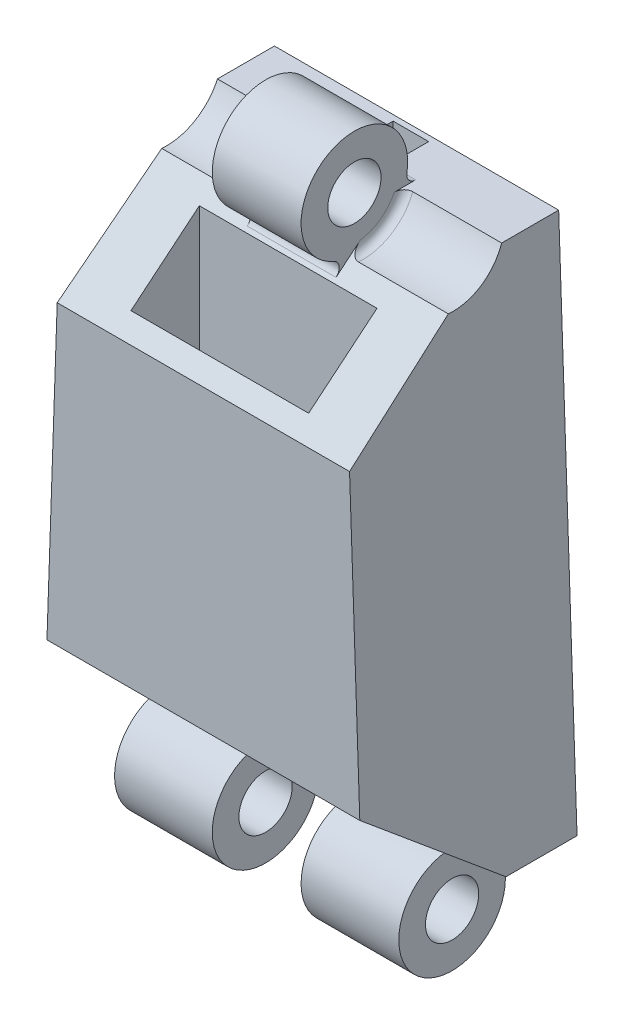
from build123d import *

# Parameters (mm, degrees)
BOSS_EXTRUDE2_DEPTH            = 12
CUT_EXTRUDE2_DEPTH             = 22.571014648492383
CUT_EXTRUDE2_DEPTH_BACK        = 22.571014648492383
SKETCH17_R                     = 3.0000000000000298
SKETCH17_R_2                   = 1.5
BOSS_EXTRUDE3_DEPTH            = 2.5
CUT_EXTRUDE3_DEPTH             = 25.679395227729078
CUT_EXTRUDE3_DEPTH_BACK        = 25.679395227729078
SKETCH19_R                     = 1.4999999999999996
BOSS_EXTRUDE4_DEPTH            = 8
SKETCH19_3_R                   = 3.0000000000000004
CUT_EXTRUDE4_DEPTH             = 2.5
CUT_EXTRUDE5_START             = 10
SKETCH20_R                     = 2.9999999999999996
CUT_EXTRUDE5_DEPTH             = 10
SKETCH21_R                     = 2.999999999999999
CUT_EXTRUDE6_DEPTH             = 10
FILLET6_R                      = 0.5000000000000004
FILLET7_R                      = 0.5000000000000004
FILLET8_R                      = 0.5000000000000004
CUT_EXTRUDE7_REACH             = 27.076
CUT_EXTRUDE7_DIRECTION_2_REACH = 27.076
CUT_EXTRUDE8_DEPTH             = 1


with BuildPart() as part:
    # Sketch1 → Boss-Extrude2 (new body)
    with BuildSketch(Plane.XY):
        Polygon((-7.999999999999995, -14.500000000000002), (-6.966131724806635, 15.482179980607619), (9.033868275193369, 15.482179980607619), (10.067736550386755, -14.500000000000002), align=None)
    extrude(amount=BOSS_EXTRUDE2_DEPTH)

    # Sketch16 → Cut-Extrude2 (cut, two sides: drawn at the far end of the back side and taken through both)
    with BuildSketch(Plane(origin=(1.0338682751933665, 0, 0), x_dir=(0, 0, -1), z_dir=(1, 0, 0)).offset(-CUT_EXTRUDE2_DEPTH_BACK)):
        Polygon((-12, 8.852541981440545), (-4, 15.482179980607619), (-12, 15.482179980607619), align=None)
    extrude(amount=CUT_EXTRUDE2_DEPTH + CUT_EXTRUDE2_DEPTH_BACK, mode=Mode.SUBTRACT)

    # Sketch17 → Boss-Extrude3 (add, symmetric)
    with BuildSketch(Plane(origin=(1.0338682751933665, 0, 0), x_dir=(0, 0, -1), z_dir=(1, 0, 0))):
        with Locations((-6.000000000000029, 16.582179980607627)):
            Circle(SKETCH17_R)
        with Locations((-6.000000000000001, 16.58217998060762)):
            Circle(SKETCH17_R_2, mode=Mode.SUBTRACT)
    extrude(amount=BOSS_EXTRUDE3_DEPTH, both=True)

    # Sketch18 → Cut-Extrude3 (cut, two sides: drawn at the far end of the back side and taken through both)
    with BuildSketch(Plane(origin=(1.0338682751933665, 0, 0), x_dir=(0, 0, -1), z_dir=(1, 0, 0)).offset(-CUT_EXTRUDE3_DEPTH_BACK)):
        Polygon((-12, -14.500000000000002), (-4, -14.500000000000002), (-12, -7.870362000832929), align=None)
    extrude(amount=CUT_EXTRUDE3_DEPTH + CUT_EXTRUDE3_DEPTH_BACK, mode=Mode.SUBTRACT)

    # Sketch19 → Boss-Extrude4 (add, symmetric)
    with BuildSketch(Plane(origin=(1.0338682751933665, 0, 0), x_dir=(0, 0, -1), z_dir=(1, 0, 0))):
        with BuildLine():
            ThreePointArc((-8.791057147390573, -14.500000000000002), (-6.5598341530436866, -18.547301430306355), (-2.9999999999999996, -15.600000000000003))
            ThreePointArc((-2.9999999999999996, -15.600000000000003), (-3.0526985696936495, -15.040165846956317), (-3.2089428526094275, -14.500000000000002))
            ThreePointArc((-3.2089428526094275, -14.500000000000002), (-6, -12.600000000000003), (-8.791057147390573, -14.500000000000002))
        make_face()
        with Locations((-6, -15.600000000000003)):
            Circle(SKETCH19_R, mode=Mode.SUBTRACT)
    extrude(amount=BOSS_EXTRUDE4_DEPTH, both=True)

    # Sketch19<3> → Cut-Extrude4 (cut, symmetric)
    with BuildSketch(Plane(origin=(1.0338682751933665, 0, 0), x_dir=(0, 0, -1), z_dir=(1, 0, 0))):
        with Locations((-6, -15.600000000000003)):
            Circle(SKETCH19_3_R)
    extrude(amount=CUT_EXTRUDE4_DEPTH, both=True, mode=Mode.SUBTRACT)

    # Sketch20 → Cut-Extrude5 (cut)
    with BuildSketch(Plane(origin=(3.5338682751933668, 0, 0), x_dir=(0, 0, -1), z_dir=(1, 0, 0)).offset(CUT_EXTRUDE5_START)):
        with Locations((-6, 16.58217998060762)):
            Circle(SKETCH20_R)
    extrude(amount=-CUT_EXTRUDE5_DEPTH, mode=Mode.SUBTRACT)

    # Sketch21 → Cut-Extrude6 (cut)
    with BuildSketch(Plane.ZY.offset(1.4661317248066335)):
        with Locations((6, 16.58217998060762)):
            Circle(SKETCH21_R)
    extrude(amount=CUT_EXTRUDE6_DEPTH, mode=Mode.SUBTRACT)

    # Fillet6
    fillet6_edges = [part.edges().sort_by_distance(p)[0] for p in [
        (1.0338682751933665, 13.59501804601977, 6.277242811538059),
    ]]
    fillet(fillet6_edges, radius=FILLET6_R)

    # Fillet7
    fillet7_edges = [part.edges().sort_by_distance(p)[0] for p in [
        (1.0338682751933665, 15.482179980607619, 3.208942852609428),
    ]]
    fillet(fillet7_edges, radius=FILLET7_R)

    # Fillet8
    fillet8_edges = [part.edges().sort_by_distance(p)[0] for p in [
        (3.5338682751933668, 14.026824950601753, 4.428325520146199),
        (-1.4661317248066335, 14.026824950601755, 4.428325520146199),
    ]]
    fillet(fillet8_edges, radius=FILLET8_R)

    # Cut-Extrude7: up to this plane
    cut_extrude7_end = Plane(origin=(-7.999999999999995, -10.561614048947142, 8.752459728929596), z_dir=(0, 0.769971126082772, -0.6380787294674758))
    # Sketch23 → Cut-Extrude7 (cut, up to the surface)
    with BuildSketch(Plane(origin=(0, 0, 0), x_dir=(1, 0, 0), z_dir=(0, 1, 0)), mode=Mode.PRIVATE) as cut_extrude7_sk1:
        Polygon((-3.966131724806632, -7.226179018286816), (-3.966131724806632, -11.076034648700675), (6.0338682751933685, -11.076034648700674), (6.0338682751933685, -7.226179018286816), align=None)
    cut_extrude7_tool1 = split(extrude(cut_extrude7_sk1.sketch, amount=-CUT_EXTRUDE7_REACH, mode=Mode.PRIVATE), bisect_by=cut_extrude7_end, keep=Keep.BOTH, mode=Mode.PRIVATE)
    add(cut_extrude7_tool1.solids().sort_by_distance((1.033868, 0, 9.151107))[0], mode=Mode.SUBTRACT)

    # Cut-Extrude7 direction 2: up to this plane
    cut_extrude7_direction_2_end = Plane(origin=(-7.999999999999995, 11.14390488681771, 9.23500691209379), z_dir=(0, 0.769971126082772, 0.6380787294674758))
    # Sketch23 → Cut-Extrude7 direction 2 (cut, up to the surface)
    with BuildSketch(Plane(origin=(0, 0, 0), x_dir=(1, 0, 0), z_dir=(0, 1, 0)), mode=Mode.PRIVATE) as cut_extrude7_direction_2_sk1:
        Polygon((-3.966131724806632, -7.226179018286816), (-3.966131724806632, -11.076034648700675), (6.0338682751933685, -11.076034648700674), (6.0338682751933685, -7.226179018286816), align=None)
    cut_extrude7_direction_2_tool1 = split(extrude(cut_extrude7_direction_2_sk1.sketch, amount=CUT_EXTRUDE7_DIRECTION_2_REACH, mode=Mode.PRIVATE), bisect_by=cut_extrude7_direction_2_end, keep=Keep.BOTH, mode=Mode.PRIVATE)
    add(cut_extrude7_direction_2_tool1.solids().sort_by_distance((1.033868, 0, 9.151107))[0], mode=Mode.SUBTRACT)

    # Sketch24 → Cut-Extrude8 (cut, symmetric)
    with BuildSketch(Plane(origin=(1.0338682751933665, 0, 0), x_dir=(0, 0, -1), z_dir=(1, 0, 0))):
        Polygon((-0.31999999999999995, -14.500000000000002), (-2.32, -14.500000000000002), (-2.32, -13.431202147601212), (-2.32, 17.71350067215456), (-0.31999999999999995, 17.71350067215456), (-0.31999999999999995, -13.431202147601212), align=None)
    extrude(amount=CUT_EXTRUDE8_DEPTH, both=True, mode=Mode.SUBTRACT)


solid = part.part
